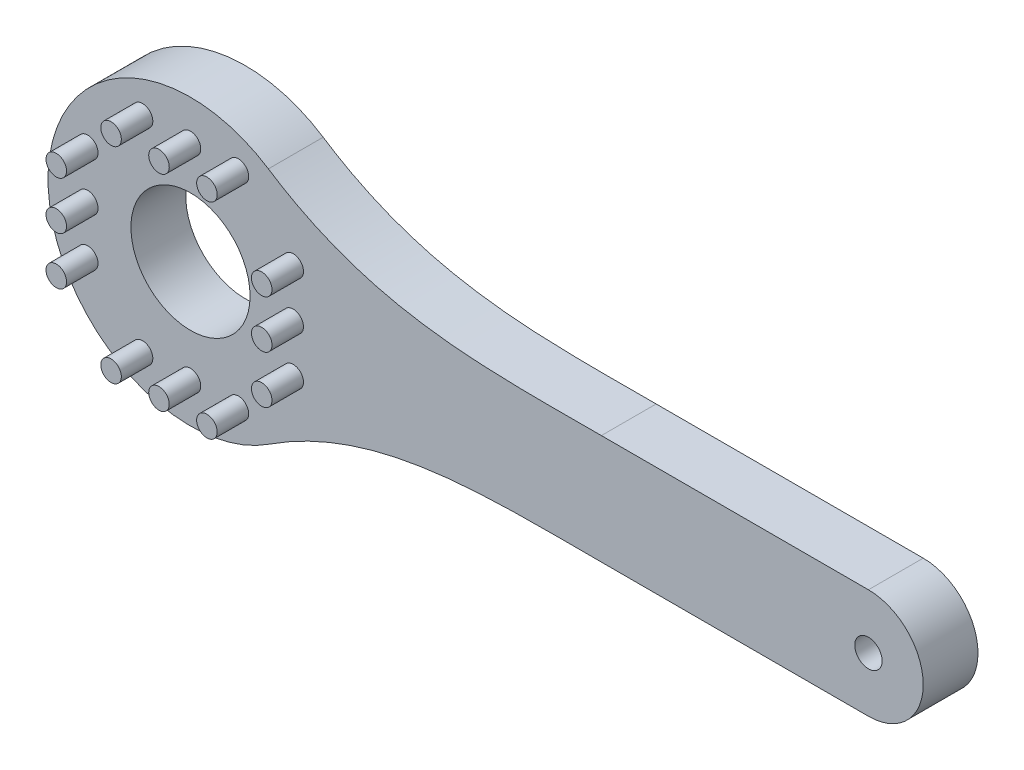
from build123d import *

# Parameters (mm, degrees)
SKETCH1_R           = 4.35
SKETCH1_R_2         = 1
BOSS_EXTRUDE1_DEPTH = 4
SKETCH2_R           = 0.75
BOSS_EXTRUDE2_DEPTH = 2.3


with BuildPart() as part:
    # Sketch1 → Boss-Extrude1 (new body)
    with BuildSketch(Plane.XY):
        with BuildLine():
            Line((30, 4), (49.5, 4))
            ThreePointArc((49.5, 4), (53.5, 0), (49.5, -4))
            Line((49.5, -4), (30, -4))
            add(Edge.make_bspline(
                [(5.686193022, -8.707882), (13.410427979, -3.664004406), (21.266865382, -4), (30, -4)],
                knots=[0, 0, 0, 0, 1, 1, 1, 1], degree=3))
            ThreePointArc((5.686193022, -8.707882), (-10.4, 0), (5.686193022, 8.707882))
            add(Edge.make_bspline(
                [(5.686193022, 8.707882), (13.410427979, 3.664004406), (21.266865382, 4), (30, 4)],
                knots=[0, 0, 0, 0, 1, 1, 1, 1], degree=3))
        make_face()
        Circle(SKETCH1_R, mode=Mode.SUBTRACT)
        with Locations((49.5, 0)):
            Circle(SKETCH1_R_2, mode=Mode.SUBTRACT)
    extrude(amount=BOSS_EXTRUDE1_DEPTH)

    # Sketch2 → Boss-Extrude2 (add)
    with BuildSketch(Plane.XY.offset(4)):
        with Locations(Location((0, 7.5, 0), (0, 0, 180))):
            Circle(SKETCH2_R)
        with Locations(Location((3.5, 7.5, 0), (0, 0, 180))):
            Circle(SKETCH2_R)
        with Locations(Location((-3.5, 7.5, 0), (0, 0, 180))):
            Circle(SKETCH2_R)
        with Locations(Location((3.5, -7.5, 0), (0, 0, 180))):
            Circle(SKETCH2_R)
        with Locations(Location((0, -7.5, 0), (0, 0, 180))):
            Circle(SKETCH2_R)
        with Locations(Location((-3.5, -7.5, 0), (0, 0, 180))):
            Circle(SKETCH2_R)
        with Locations(Location((7.5, 0, 0), (0, 0, 180))):
            Circle(SKETCH2_R)
        with Locations(Location((7.5, 3.5, 0), (0, 0, 180))):
            Circle(SKETCH2_R)
        with Locations(Location((7.5, -3.5, 0), (0, 0, 180))):
            Circle(SKETCH2_R)
        with Locations(Location((-7.5, -3.5, 0), (0, 0, 180))):
            Circle(SKETCH2_R)
        with Locations(Location((-7.5, 0, 0), (0, 0, 180))):
            Circle(SKETCH2_R)
        with Locations(Location((-7.5, 3.5, 0), (0, 0, 180))):
            Circle(SKETCH2_R)
    extrude(amount=BOSS_EXTRUDE2_DEPTH)


solid = part.part
